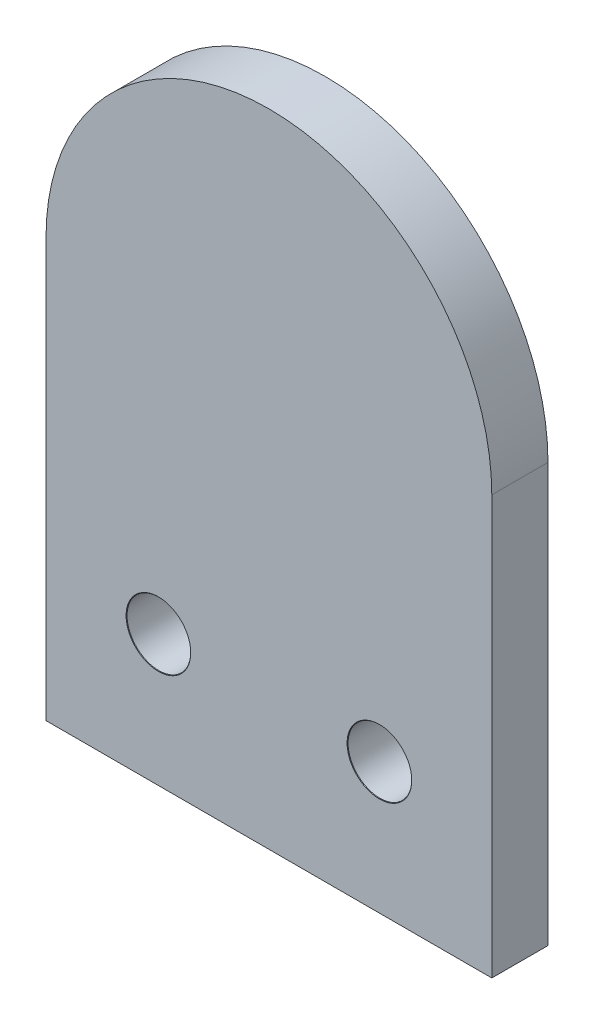
from build123d import *

# Parameters (mm, degrees)
BOSS_EXTRUDE1_DEPTH            = 3
SKETCH2_R                      = 1.95
BOSS_EXTRUDE2_DEPTH            = 3
M3_CLEARANCE_HOLE1_D           = 3.4
M3_CLEARANCE_HOLE1_CSINK_D     = 3.45
M3_CLEARANCE_HOLE1_CSINK_ANGLE = 90


with BuildPart() as part:
    # Sketch1 → Boss-Extrude1 (new body)
    with BuildSketch(Plane.XY):
        with BuildLine():
            Line((-11.9, 0), (-11.9, -22.34))
            Line((-11.9, -22.34), (11.9, -22.34))
            Line((11.9, -22.34), (11.9, 0))
            ThreePointArc((11.9, 0), (0, 11.9), (-11.9, 0))
        make_face()
    extrude(amount=BOSS_EXTRUDE1_DEPTH)

    # Sketch2 → Boss-Extrude2 (add)
    with BuildSketch(Plane(origin=(0, 0, 0), x_dir=(-1, 0, 0), z_dir=(0, 0, -1))):
        with Locations(Location((0, 6, 0), (0, 0, 180))):
            Circle(SKETCH2_R)
        with Locations(Location((6, 0, 0), (0, 0, 180))):
            Circle(SKETCH2_R)
        with Locations(Location((0, -6, 0), (0, 0, 180))):
            Circle(SKETCH2_R)
        with Locations(Location((-6, 0, 0), (0, 0, 180))):
            Circle(SKETCH2_R)
    extrude(amount=BOSS_EXTRUDE2_DEPTH)

    # M3 Clearance Hole1 (through all)
    with Locations(Plane(origin=(-5.9, -15.34, 3), x_dir=(1, 0, 0), z_dir=(0, 0, 1))):
        with Locations((0, 0), (11.8, 0)):
            CounterSinkHole(M3_CLEARANCE_HOLE1_D / 2, M3_CLEARANCE_HOLE1_CSINK_D / 2, counter_sink_angle=M3_CLEARANCE_HOLE1_CSINK_ANGLE)


solid = part.part
